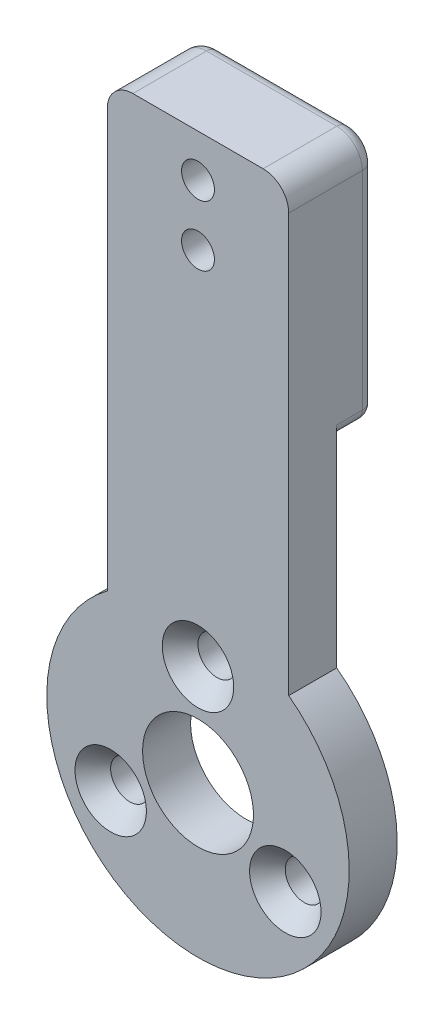
from build123d import *

# Parameters (mm, degrees)
SKETCH1_R                                      = 5.5
BODY_DEPTH                                     = 4.7625
HEX_NUTYFOOT_DEPTH                             = 3.81
F_4_CLEARANCE_HOLE1_D                          = 3.2639
SKETCH7_R                                      = 1.63195
HEX_NUT_RECESS_DEPTH                           = 3.048
CSK_FOR_6_FLAT_HEAD_MACHINE_SCREW1_D           = 3.7973
CSK_FOR_6_FLAT_HEAD_MACHINE_SCREW1_CSINK_D     = 7.0866
CSK_FOR_6_FLAT_HEAD_MACHINE_SCREW1_CSINK_ANGLE = 82
FILLET1_R                                      = 2.54
FILLET2_R                                      = 1.27


with BuildPart() as part:
    # Sketch1 → Body (new body)
    with BuildSketch(Plane.XY):
        with BuildLine():
            ThreePointArc((-9, 12), (0, -15), (9, 12))
            Line((9, 12), (9, 56))
            Line((9, 56), (-9, 56))
            Line((-9, 56), (-9, 12))
        make_face()
        Circle(SKETCH1_R, mode=Mode.SUBTRACT)
    extrude(amount=BODY_DEPTH)

    # Sketch1<3> → Hex NutyFoot (add)
    with BuildSketch(Plane.XY):
        with BuildLine():
            ThreePointArc((-9, 31.228992939), (0, 32.5), (9, 31.228992939))
            Line((9, 31.228992939), (9, 56))
            Line((9, 56), (-9, 56))
            Line((-9, 56), (-9, 31.228992939))
        make_face()
    extrude(amount=-HEX_NUTYFOOT_DEPTH)

    # #4 Clearance Hole1 (through all)
    with Locations(Plane(origin=(0, 45.78, 4.7625), x_dir=(1, 0, 0), z_dir=(0, 0, 1))):
        with Locations((0, 0), (0, 6)):
            Hole(F_4_CLEARANCE_HOLE1_D / 2)

    # Sketch7 → Hex Nut Recess (cut)
    # profile 1 of 2: a face of its own
    with BuildSketch(Plane(origin=(0, 0, -3.81), x_dir=(-1, 0, 0), z_dir=(0, 0, -1))):
        Polygon((2.667, 45.78), (1.3335, 48.089689752), (-1.3335, 48.089689752), (-2.667, 45.78), (-1.3335, 43.470310248), (1.3335, 43.470310248), align=None)
        with Locations((0, 45.78)):
            Circle(SKETCH7_R, mode=Mode.SUBTRACT)
    # profile 2 of 2: a face of its own
    with BuildSketch(Plane(origin=(0, 0, -3.81), x_dir=(-1, 0, 0), z_dir=(0, 0, -1))):
        Polygon((2.667, 51.78), (1.3335, 54.089689752), (-1.3335, 54.089689752), (-2.667, 51.78), (-1.3335, 49.470310248), (1.3335, 49.470310248), align=None)
        with Locations((0, 51.78)):
            Circle(SKETCH7_R, mode=Mode.SUBTRACT)
    extrude(amount=-HEX_NUT_RECESS_DEPTH, mode=Mode.SUBTRACT)

    # CSK for #6 Flat Head Machine Screw1 (through all)
    with Locations(Plane(origin=(0, 10, 4.7625), x_dir=(1, 0, 0), z_dir=(0, 0, 1))):
        with Locations((0, 0), (8.660254038, -15), (-8.660254038, -15)):
            CounterSinkHole(CSK_FOR_6_FLAT_HEAD_MACHINE_SCREW1_D / 2, CSK_FOR_6_FLAT_HEAD_MACHINE_SCREW1_CSINK_D / 2, counter_sink_angle=CSK_FOR_6_FLAT_HEAD_MACHINE_SCREW1_CSINK_ANGLE)

    # Fillet1
    fillet1_edges = [part.edges().sort_by_distance(p)[0] for p in [
        (-9, 56, 0.47625),
        (9, 56, 0.47625),
    ]]
    fillet(fillet1_edges, radius=FILLET1_R)

    # Fillet2
    fillet2_edges = [part.edges().sort_by_distance(p)[0] for p in [
        (-9, 42.34449647, -3.81),
        (-8.256051224, 55.256051224, -3.81),
        (0, 56, -3.81),
        (8.256051224, 55.256051224, -3.81),
        (-9, 31.228992939, -1.905),
        (9, 31.228992939, -1.905),
        (0, 32.5, -3.81),
        (9, 42.34449647, -3.81),
    ]]
    fillet(fillet2_edges, radius=FILLET2_R)


solid = part.part
